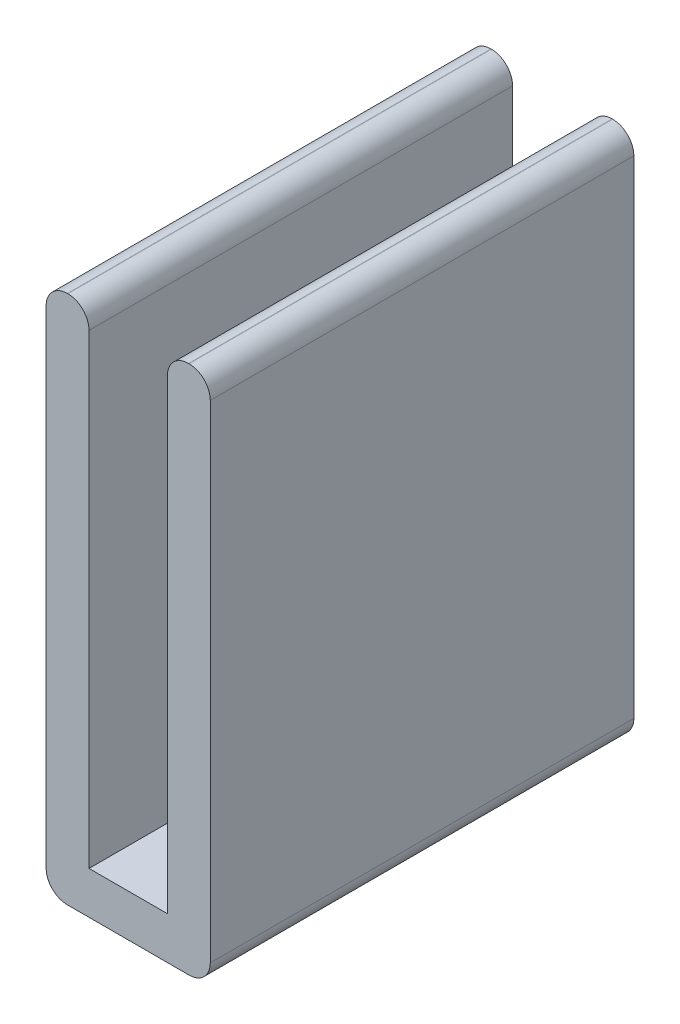
from build123d import *

# Parameters (mm, degrees)
BOSS_EXTRUDE1_DEPTH = 8


with BuildPart() as part:
    # Sketch1 → Boss-Extrude1 (new body)
    with BuildSketch(Plane.XY):
        with BuildLine():
            Line((2.69, 10), (2.7, 10))
            ThreePointArc((2.7, 10), (2.982842712, 9.882842712), (3.1, 9.6))
            Line((3.1, 9.6), (3.1, 0.4))
            ThreePointArc((3.1, 0.4), (2.982842712, 0.117157288), (2.7, 0))
            Line((2.7, 0), (0.4, 0))
            ThreePointArc((0.4, 0), (0.117157288, 0.117157288), (0, 0.4))
            Line((0, 0.4), (0, 9.6))
            ThreePointArc((0, 9.6), (0.117157288, 9.882842712), (0.4, 10))
            Line((0.4, 10), (0.41, 10))
            ThreePointArc((0.41, 10), (0.692842712, 9.882842712), (0.81, 9.6))
            Line((0.81, 9.6), (0.81, 0.8))
            Line((0.81, 0.8), (2.29, 0.8))
            Line((2.29, 0.8), (2.29, 9.6))
            ThreePointArc((2.29, 9.6), (2.407157288, 9.882842712), (2.69, 10))
        make_face()
    extrude(amount=BOSS_EXTRUDE1_DEPTH)


solid = part.part
